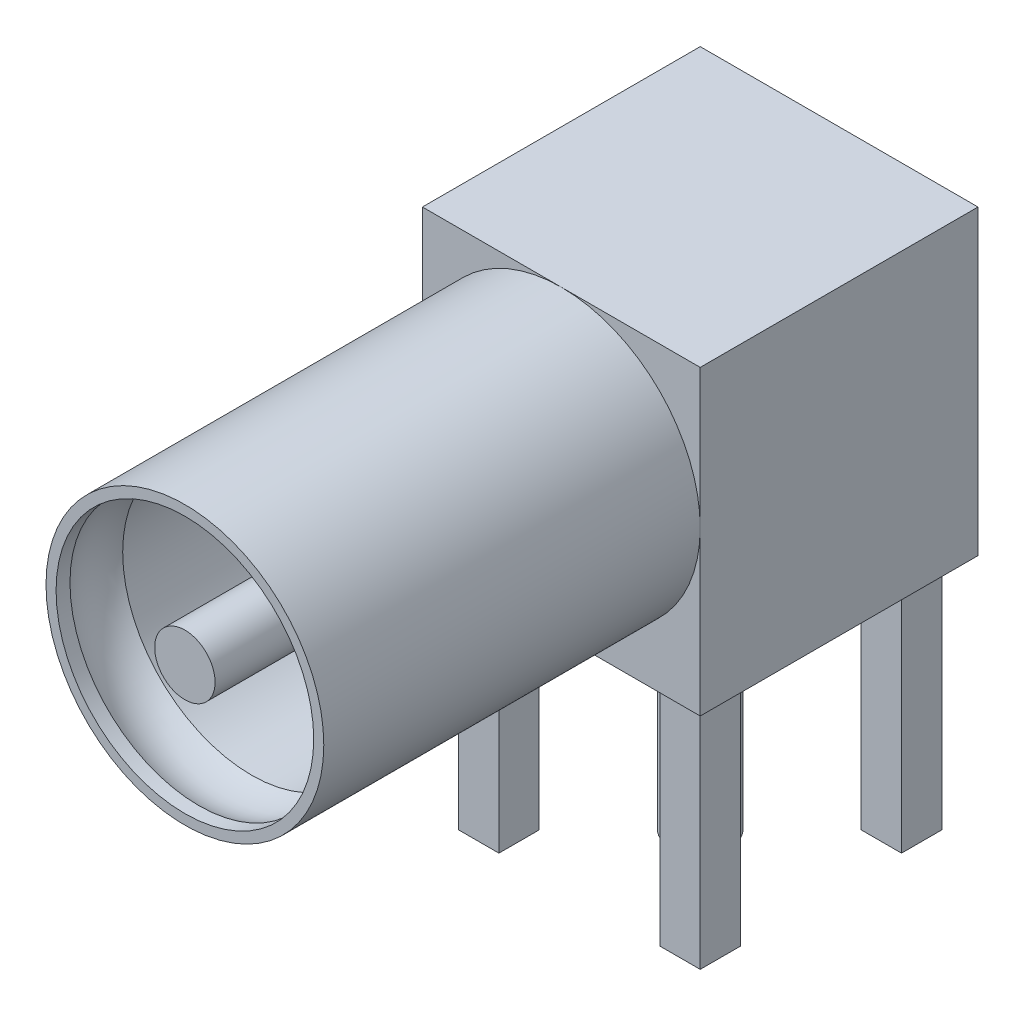
from build123d import *

# Parameters (mm, degrees)
SKETCH1_W           = 3.5052
SKETCH1_H           = 3.5052
BOSS_EXTRUDE1_DEPTH = 3.81
SKETCH2_R           = 1.7526
BOSS_EXTRUDE2_DEPTH = 4.7498
SKETCH3_R           = 0.381
SKETCH3_W           = 0.508
SKETCH3_H           = 0.508
BOSS_EXTRUDE3_DEPTH = 2.9972
CUT_EXTRUDE2_START  = -0.0254
SKETCH4_R           = 1.27
SKETCH4_R_2         = 0.381
CUT_EXTRUDE2_DEPTH  = 0.0254
SKETCH5_R           = 1.6256
SKETCH5_R_2         = 0.381
CUT_EXTRUDE3_DEPTH  = 2.286
SKETCH6_R           = 0.66675


with BuildPart() as part:
    # Sketch1 → Boss-Extrude1 (new body)
    with BuildSketch(Plane(origin=(0, 0, 0), x_dir=(1, 0, 0), z_dir=(0, 1, 0))):
        Rectangle(SKETCH1_W, SKETCH1_H)
    extrude(amount=BOSS_EXTRUDE1_DEPTH)

    # Sketch2 → Boss-Extrude2 (add)
    with BuildSketch(Plane.XY.offset(1.7526)):
        with Locations((0, 2.0574)):
            Circle(SKETCH2_R)
    extrude(amount=BOSS_EXTRUDE2_DEPTH)

    # Sketch3 → Boss-Extrude3 (add)
    with BuildSketch(Plane.XZ):
        Circle(SKETCH3_R)
        with Locations((-1.27, 1.27)):
            Rectangle(SKETCH3_W, SKETCH3_H)
        with Locations((1.27, 1.27)):
            Rectangle(SKETCH3_W, SKETCH3_H)
        with Locations((-1.27, -1.27)):
            Rectangle(SKETCH3_W, SKETCH3_H)
        with Locations((1.27, -1.27)):
            Rectangle(SKETCH3_W, SKETCH3_H)
    extrude(amount=BOSS_EXTRUDE3_DEPTH)

    # Sketch4 → Cut-Extrude2 (cut)
    with BuildSketch(Plane.XZ.offset(CUT_EXTRUDE2_START)):
        Circle(SKETCH4_R)
        Circle(SKETCH4_R_2, mode=Mode.SUBTRACT)
    extrude(amount=CUT_EXTRUDE2_DEPTH, mode=Mode.SUBTRACT)

    # Sketch5 → Cut-Extrude3 (cut)
    with BuildSketch(Plane.XY.offset(6.5024)):
        with Locations((0, 2.0574)):
            Circle(SKETCH5_R)
        with Locations((0, 2.0574)):
            Circle(SKETCH5_R_2, mode=Mode.SUBTRACT)
    extrude(amount=-CUT_EXTRUDE3_DEPTH, mode=Mode.SUBTRACT)

    # Sketch6 → Cut-Revolve1 (revolve, cut)
    with BuildSketch(Plane(origin=(0, 0, 0), x_dir=(0, 0, -1), z_dir=(1, 0, 0))):
        with Locations((-5.9944, 1.00965)):
            Circle(SKETCH6_R)
    revolve(axis=Axis((0, 2.0574, 9.059220752), (0, 0, -1)), mode=Mode.SUBTRACT)


solid = part.part
